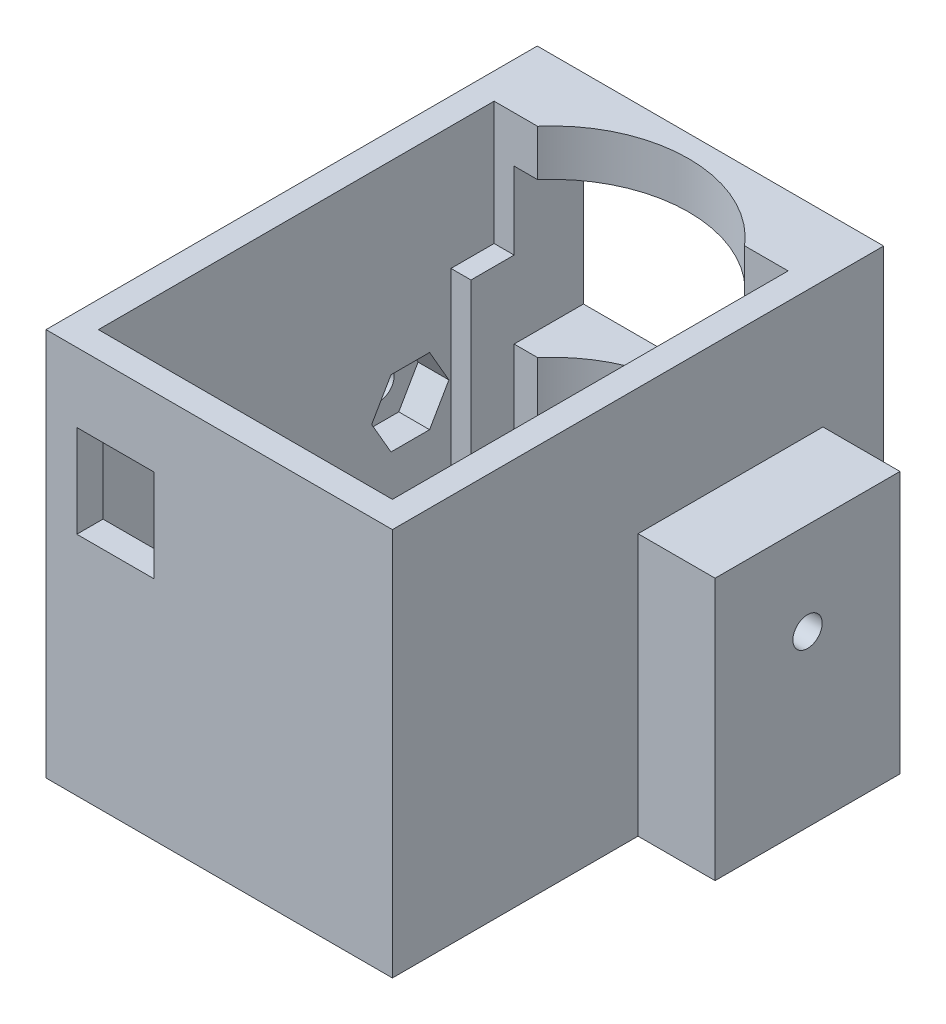
from build123d import *

# Parameters (mm, degrees)
BOSS_EXTRUDE1_DEPTH = 23.2
BOSS_EXTRUDE2_START = 2
SKETCH2_W           = 5
SKETCH2_H           = 1.7
BOSS_EXTRUDE2_DEPTH = 2
SKETCH3_W           = 5
SKETCH3_H           = 6
CUT_EXTRUDE1_DEPTH  = 2
SKETCH4_W           = 16.48
SKETCH4_H           = 10
CUT_EXTRUDE2_DEPTH  = 7
SKETCH6_W           = 2.8
SKETCH6_H           = 17.2
BOSS_EXTRUDE4_DEPTH = 1.3
SKETCH8_W           = 2.8
SKETCH8_H           = 17.2
BOSS_EXTRUDE5_DEPTH = 1.3
SKETCH12_W          = 12
SKETCH12_H          = 17
SKETCH12_R          = 0.95
BOSS_EXTRUDE6_DEPTH = 5
BOSS_EXTRUDE7_START = 5
SKETCH13_W          = 12
SKETCH13_H          = 17
SKETCH13_R          = 0.95
BOSS_EXTRUDE7_DEPTH = 5
CUT_EXTRUDE3_START  = -22.78
CUT_EXTRUDE3_DEPTH  = 24.78


with BuildPart() as part:
    # Sketch1 → Boss-Extrude1 (new body)
    with BuildSketch(Plane(origin=(0, 0, 0), x_dir=(1, 0, 0), z_dir=(0, 1, 0))):
        Polygon((18.223177083, -5.972057292), (-0.856822917, -5.972057292), (-0.856822917, -7.672057292), (19.923177083, -7.672057292), (19.923177083, 24.207942708), (18.223177083, 24.207942708), (18.223177083, 19.707942708), align=None)
        with BuildLine():
            Line((-0.856822917, -7.672057292), (-0.856822917, -5.972057292))
            Line((-0.856822917, -5.972057292), (-0.856822917, 19.707942708))
            Line((-0.856822917, 19.707942708), (1.966174404, 19.707942708))
            ThreePointArc((1.966174404, 19.707942708), (8.683177083, 22.792942708), (15.400179763, 19.707942708))
            Line((15.400179763, 19.707942708), (18.223177083, 19.707942708))
            Line((18.223177083, 19.707942708), (18.223177083, 24.207942708))
            Line((18.223177083, 24.207942708), (-2.556822917, 24.207942708))
            Line((-2.556822917, 24.207942708), (-2.556822917, -7.672057292))
            Line((-2.556822917, -7.672057292), (-0.856822917, -7.672057292))
        make_face()
    extrude(amount=BOSS_EXTRUDE1_DEPTH)

    # Sketch2 → Boss-Extrude2 (add)
    with BuildSketch(Plane.XZ.offset(BOSS_EXTRUDE2_START)):
        with BuildLine():
            Line((3.683177083, 5.972057292), (3.683177083, 7.672057292))
            Line((3.683177083, 7.672057292), (-2.556822917, 7.672057292))
            Line((-2.556822917, 7.672057292), (-2.556822917, -24.207942708))
            Line((-2.556822917, -24.207942708), (3.683177083, -24.207942708))
            Line((3.683177083, -24.207942708), (3.683177083, -21.246227391))
            ThreePointArc((3.683177083, -21.246227391), (2.774402431, -20.533199118), (1.966174404, -19.707942708))
            Line((1.966174404, -19.707942708), (-0.856822917, -19.707942708))
            Line((-0.856822917, -19.707942708), (-0.856822917, 5.972057292))
            Line((-0.856822917, 5.972057292), (3.683177083, 5.972057292))
        make_face()
        with BuildLine():
            Line((8.683177083, -24.207942708), (8.683177083, -22.792942708))
            ThreePointArc((8.683177083, -22.792942708), (6.066293045, -22.397431046), (3.683177083, -21.246227391))
            Line((3.683177083, -21.246227391), (3.683177083, -24.207942708))
            Line((3.683177083, -24.207942708), (8.683177083, -24.207942708))
        make_face()
        with BuildLine():
            ThreePointArc((13.683177083, -21.246227391), (11.300061121, -22.397431046), (8.683177083, -22.792942708))
            Line((8.683177083, -22.792942708), (8.683177083, -24.207942708))
            Line((8.683177083, -24.207942708), (13.683177083, -24.207942708))
            Line((13.683177083, -24.207942708), (13.683177083, -21.246227391))
        make_face()
        with BuildLine():
            Line((19.923177083, 7.672057292), (13.683177083, 7.672057292))
            Line((13.683177083, 7.672057292), (13.683177083, 5.972057292))
            Line((13.683177083, 5.972057292), (18.223177083, 5.972057292))
            Line((18.223177083, 5.972057292), (18.223177083, -19.707942708))
            Line((18.223177083, -19.707942708), (15.400179763, -19.707942708))
            ThreePointArc((15.400179763, -19.707942708), (14.591951736, -20.533199118), (13.683177083, -21.246227391))
            Line((13.683177083, -21.246227391), (13.683177083, -24.207942708))
            Line((13.683177083, -24.207942708), (19.923177083, -24.207942708))
            Line((19.923177083, -24.207942708), (19.923177083, 7.672057292))
        make_face()
        with Locations((11.183177083, 6.822057292)):
            Rectangle(SKETCH2_W, SKETCH2_H)
        with Locations((6.183177083, 6.822057292)):
            Rectangle(SKETCH2_W, SKETCH2_H)
        with BuildLine():
            Line((13.683177083, 5.972057292), (8.683177083, 5.972057292))
            Line((8.683177083, 5.972057292), (8.683177083, -22.792942708))
            ThreePointArc((8.683177083, -22.792942708), (11.300061121, -22.397431046), (13.683177083, -21.246227391))
            Line((13.683177083, -21.246227391), (13.683177083, 5.972057292))
        make_face()
        with BuildLine():
            Line((8.683177083, -22.792942708), (8.683177083, 5.972057292))
            Line((8.683177083, 5.972057292), (3.683177083, 5.972057292))
            Line((3.683177083, 5.972057292), (3.683177083, -21.246227391))
            ThreePointArc((3.683177083, -21.246227391), (6.066293045, -22.397431046), (8.683177083, -22.792942708))
        make_face()
    extrude(amount=-BOSS_EXTRUDE2_DEPTH)

    # Sketch3 → Cut-Extrude1 (cut)
    with BuildSketch(Plane.XY.offset(7.672057292)):
        with Locations((1.943177083, 15.7)):
            Rectangle(SKETCH3_W, SKETCH3_H)
    extrude(amount=-CUT_EXTRUDE1_DEPTH, mode=Mode.SUBTRACT)

    # Sketch4 → Cut-Extrude2 (cut)
    with BuildSketch(Plane(origin=(0, 0, -24.207942708), x_dir=(-1, 0, 0), z_dir=(0, 0, -1))):
        with Locations((-8.683177083, 15.2)):
            Rectangle(SKETCH4_W, SKETCH4_H)
    extrude(amount=-CUT_EXTRUDE2_DEPTH, mode=Mode.SUBTRACT)

    # Sketch6 → Boss-Extrude4 (add)
    with BuildSketch(Plane.ZY.offset(-18.223177083)):
        with Locations((-18.307942708, 6.6)):
            Rectangle(SKETCH6_W, SKETCH6_H)
    extrude(amount=BOSS_EXTRUDE4_DEPTH)

    # Sketch8 → Boss-Extrude5 (add)
    with BuildSketch(Plane(origin=(-0.856822917, 0, 0), x_dir=(0, 0, -1), z_dir=(1, 0, 0))):
        with Locations((18.307942708, 6.6)):
            Rectangle(SKETCH8_W, SKETCH8_H)
    extrude(amount=BOSS_EXTRUDE5_DEPTH)

    # Sketch12 → Boss-Extrude6 (add)
    with BuildSketch(Plane(origin=(19.923177083, 0, 0), x_dir=(0, 0, -1), z_dir=(1, 0, 0))):
        with Locations((14.267942708, 6.5)):
            Rectangle(SKETCH12_W, SKETCH12_H)
        with Locations((14.267942708, 9)):
            Circle(SKETCH12_R, mode=Mode.SUBTRACT)
    extrude(amount=BOSS_EXTRUDE6_DEPTH)

    # Sketch13 → Boss-Extrude7 (add)
    with BuildSketch(Plane.ZY.offset(2.556822917).offset(BOSS_EXTRUDE7_START)):
        with Locations((-14.267942708, 6.5)):
            Rectangle(SKETCH13_W, SKETCH13_H)
        with Locations(Location((-14.267942708, 9, 0), (0, 0, 180))):
            Circle(SKETCH13_R, mode=Mode.SUBTRACT)
    extrude(amount=-BOSS_EXTRUDE7_DEPTH)

    # Sketch15 → Cut-Extrude3 (cut)
    with BuildSketch(Plane(origin=(19.923177083, 0, 0), x_dir=(0, 0, -1), z_dir=(1, 0, 0)).offset(CUT_EXTRUDE3_START)):
        Polygon((16.773642877, 9), (15.520792792, 11.17), (13.015092624, 11.17), (11.76224254, 9), (13.015092624, 6.83), (15.520792792, 6.83), align=None)
    extrude(amount=CUT_EXTRUDE3_DEPTH, mode=Mode.SUBTRACT)


solid = part.part
